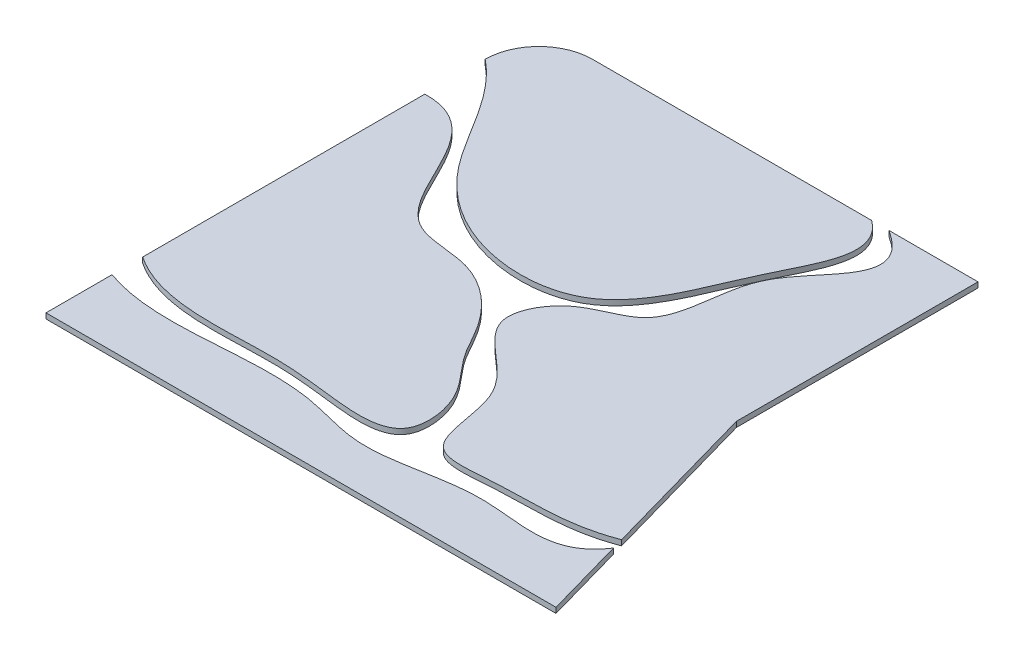
from build123d import *

# Parameters (mm, degrees)
EXTRUDE_4_DEPTH   = 10
EXTRUDE_4_2_DEPTH = 10
EXTRUDE_4_3_DEPTH = 10
EXTRUDE_4_4_DEPTH = 10


with BuildPart() as part:
    # 草图1 → 凸台-拉伸4 (new body)
    with BuildSketch(Plane(origin=(0, 0, 0), x_dir=(1, 0, 0), z_dir=(0, 1, 0))):
        with BuildLine():
            add(Edge.make_bspline(
                [(210.868291071, 458), (269.589316795, 414.930776235), (222.943597072, 326.171009864), (177.782564772, 228.677919451), (145.156787101, 147.87181362), (67.223880115, 35.666252711), (-119.045799991, 36.504185318), (-246.879340721, 130.670668224), (-319.221459075, 251.456304014), (-366.458980173, 324.006011189), (-409, 358)],
                knots=[0, 0, 0, 0, 0.163728442, 0.235377211, 0.313668619, 0.410963639, 0.603027814, 0.754879506, 0.848370003, 1, 1, 1, 1], degree=3))
            ThreePointArc((-409, 358), (-379.710678119, 428.710678119), (-309, 458))
            Line((-309, 458), (210.868291071, 458))
        make_face()
    extrude(amount=EXTRUDE_4_DEPTH)


with BuildPart() as body_2:
    # 草图1 → Extrude 4 2 (new body)
    with BuildSketch(Plane(origin=(0, 0, 0), x_dir=(1, 0, 0), z_dir=(0, 1, 0))):
        with BuildLine():
            Line((-409, 245.580356436), (-409, -279.882850733))
            add(Edge.make_bspline(
                [(-409, 245.580356436), (-275.993080971, 249.67464746), (-283.602777577, 7.370788986), (-74.803745743, 19.744676597), (8.390053541, -58.203971056), (52.977793648, -153.228845866), (116.989970073, -206.854063036), (133.000643295, -345.497902872), (-10.047723972, -329.363469332), (-171.74536102, -310.363611115), (-318.826566789, -340.399765198), (-409, -279.882850733)],
                knots=[0, 0, 0, 0, 0.233311569, 0.306255308, 0.417893684, 0.46387814, 0.538957902, 0.605999424, 0.700982218, 0.770983119, 1, 1, 1, 1], degree=3))
        make_face()
    extrude(amount=EXTRUDE_4_2_DEPTH)


with BuildPart() as body_3:
    # 草图1 → Extrude 4 3 (new body)
    with BuildSketch(Plane(origin=(0, 0, 0), x_dir=(1, 0, 0), z_dir=(0, 1, 0))):
        with BuildLine():
            Line((409, 458), (409, 8))
            Line((409, 8), (493.02995153, -289.924373606))
            add(Edge.make_bspline(
                [(243, 458), (349.792563252, 390.973836458), (213.96274263, 317.054977903), (186.913088276, 187.44659362), (177.707663744, 74.856334367), (63.930178811, 57.213587703), (-6.80416306, -75.316966125), (170.350641389, -139.1916096), (143.991792504, -330.865859781), (329.024238386, -307.915291767), (414.200144681, -319.688768205), (493.02995153, -289.924373606)],
                knots=[0, 0, 0, 0, 0.184875451, 0.245347746, 0.332115564, 0.420312273, 0.488752844, 0.627085994, 0.747050317, 0.817526216, 1, 1, 1, 1], degree=3))
            Line((243, 458), (409, 458))
        make_face()
    extrude(amount=EXTRUDE_4_3_DEPTH)


with BuildPart() as body_4:
    # 草图1 → Extrude 4 4 (new body)
    with BuildSketch(Plane(origin=(0, 0, 0), x_dir=(1, 0, 0), z_dir=(0, 1, 0))):
        with BuildLine():
            Line((-409, -460), (541, -460))
            Line((541, -460), (498.923674422, -310.820300222))
            add(Edge.make_bspline(
                [(-409, -337), (-282.053839651, -381.85033693), (-112.633395527, -318.254759818), (117.766188012, -397.110113328), (292.633766387, -325.190205846), (450.400424233, -384.951409885), (498.923674422, -310.820300222)],
                knots=[0, 0, 0, 0, 0.42068171, 0.530959381, 0.765334228, 1, 1, 1, 1], degree=3))
            Line((-409, -337), (-409, -460))
        make_face()
    extrude(amount=EXTRUDE_4_4_DEPTH)


solid = Compound([part.part, body_2.part, body_3.part, body_4.part])
